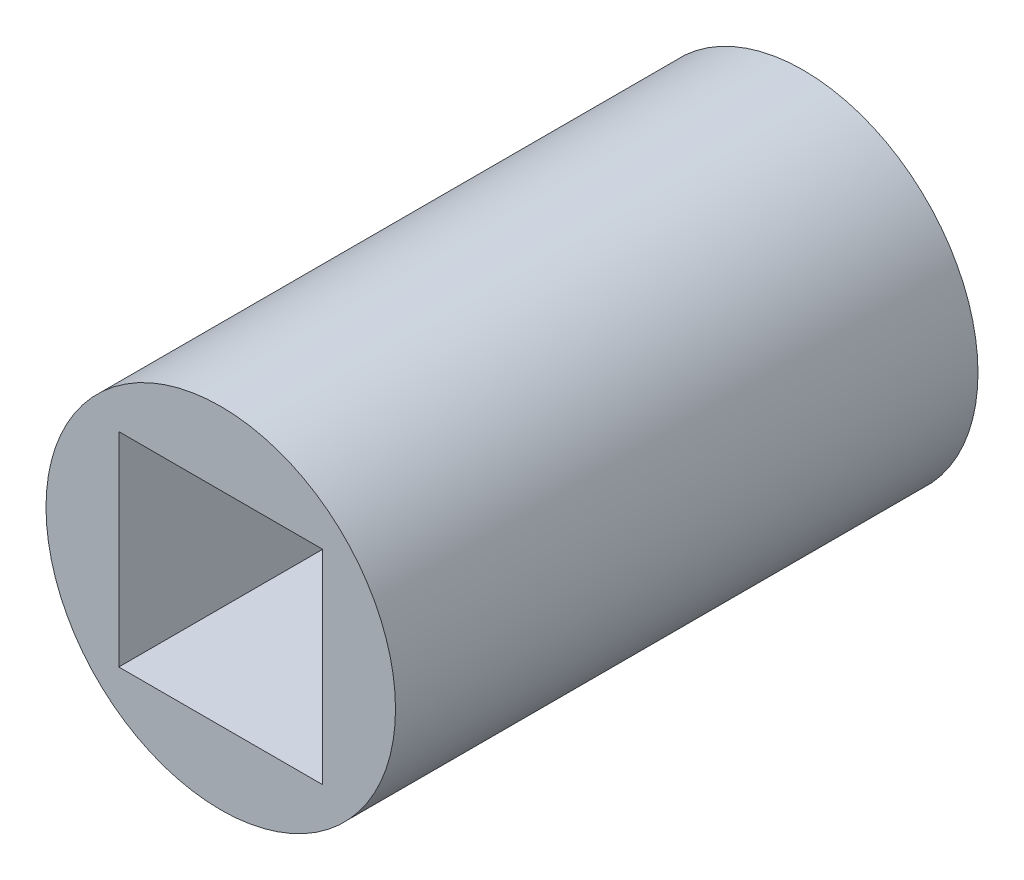
from build123d import *

# Parameters (mm, degrees)
SKETCH_1_R      = 30
SKETCH_1_W      = 35
SKETCH_1_H      = 35
EXTRUDE_1_DEPTH = 100


with BuildPart() as part:
    # 草图1 → 凸台-拉伸1 (new body)
    with BuildSketch(Plane.XY):
        with Locations((17.5, 17.5)):
            Circle(SKETCH_1_R)
        with Locations((17.5, 17.5)):
            Rectangle(SKETCH_1_W, SKETCH_1_H, mode=Mode.SUBTRACT)
    extrude(amount=EXTRUDE_1_DEPTH)


solid = part.part
